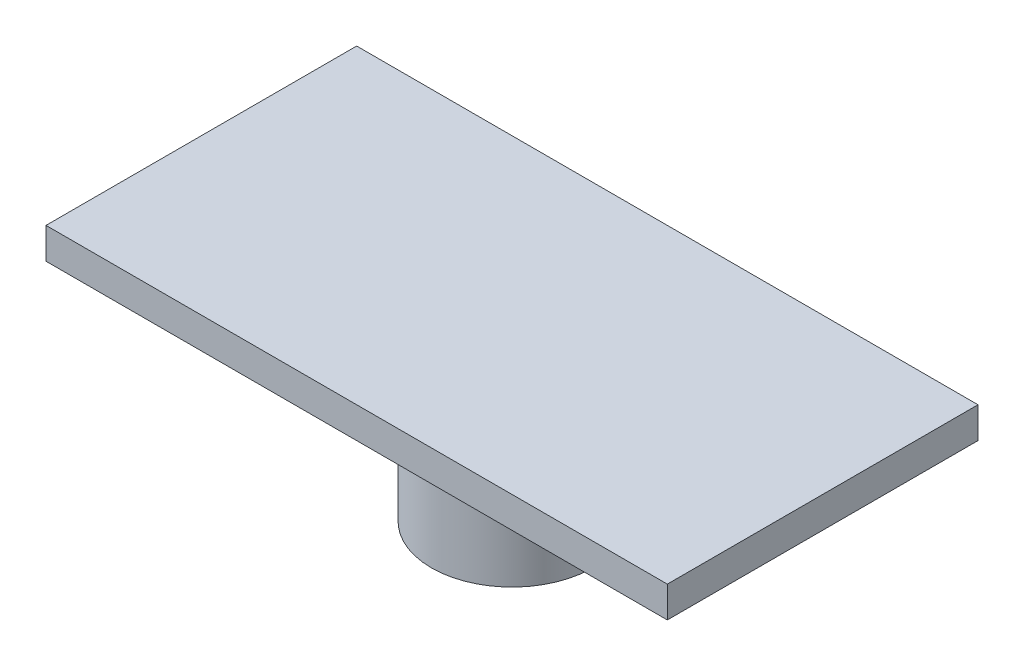
from build123d import *

# Parameters (mm, degrees)
SKETCH2_R           = 5.189332
BOSS_EXTRUDE1_DEPTH = 9.5
CUT_EXTRUDE1_DEPTH  = 11.8
SKETCH5_W           = 40
SKETCH5_H           = 20
BOSS_EXTRUDE2_DEPTH = 2


with BuildPart() as part:
    # Sketch2 → Boss-Extrude1 (new body)
    with BuildSketch(Plane(origin=(0, 0, 0), x_dir=(1, 0, 0), z_dir=(0, 1, 0))):
        with Locations(Location((0, 0, 0), (0, 0, 270))):
            Circle(SKETCH2_R)
    extrude(amount=BOSS_EXTRUDE1_DEPTH)

    # Sketch4 → Cut-Extrude1 (cut)
    with BuildSketch(Plane(origin=(0, 9.5, 0), x_dir=(1, 0, 0), z_dir=(0, 1, 0))):
        with BuildLine():
            Line((0, 1.625), (-2.5, 1.625))
            ThreePointArc((-2.5, 1.625), (-3.173097039, 0), (-2.5, -1.625))
            Line((-2.5, -1.625), (0, -1.625))
            Line((0, -1.625), (0, 0))
            Line((0, 0), (0, 1.625))
        make_face()
        with BuildLine():
            ThreePointArc((2.5, 1.625), (3.173097039, 0), (2.5, -1.625))
            Line((2.5, -1.625), (0, -1.625))
            Line((0, -1.625), (0, 0))
            Line((0, 0), (0, 1.625))
            Line((0, 1.625), (2.5, 1.625))
        make_face()
    extrude(amount=-CUT_EXTRUDE1_DEPTH, mode=Mode.SUBTRACT)

    # Sketch5 → Boss-Extrude2 (add)
    with BuildSketch(Plane(origin=(0, 9.5, 0), x_dir=(1, 0, 0), z_dir=(0, 1, 0))):
        Rectangle(SKETCH5_W, SKETCH5_H)
    extrude(amount=BOSS_EXTRUDE2_DEPTH)


solid = part.part
